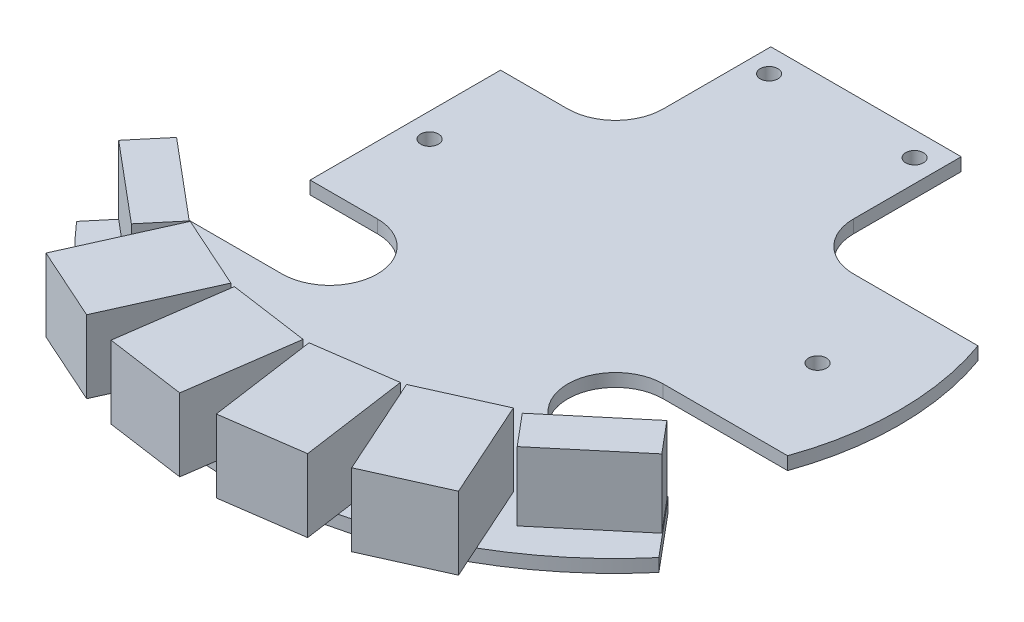
from build123d import *

# Parameters (mm, degrees)
BOSS_EXTRUDE1_DEPTH = 1.6
BOSS_EXTRUDE2_DEPTH = 8.5
BOSS_EXTRUDE3_DEPTH = 9
SKETCH4_R           = 1.1
CUT_EXTRUDE1_DEPTH  = 64.607734681


with BuildPart() as part:
    # Sketch1 → Boss-Extrude1 (new body)
    with BuildSketch(Plane(origin=(0, 0, 0), x_dir=(1, 0, 0), z_dir=(0, 1, 0))):
        with BuildLine():
            Line((-11.77766953, 17.67766953), (-11.77766953, 31))
            Line((-11.77766953, 31), (11.77766953, 31))
            Line((11.77766953, 31), (11.77766953, 17.67766953))
            ThreePointArc((11.77766953, 17.67766953), (13.505739521, 13.505739521), (17.67766953, 11.77766953))
            Line((17.67766953, 11.77766953), (33.07278358, 11.77766953))
            ThreePointArc((33.07278358, 11.77766953), (35.1073, 0), (33.07278358, -11.77766953))
            Line((33.07278358, -11.77766953), (17.67766953, -11.77766953))
            ThreePointArc((17.67766953, -11.77766953), (11.77766953, -17.67766953), (17.67766953, -23.57766953))
            Line((17.67766953, -23.57766953), (30.09766953, -23.57766953))
            Line((30.09766953, -23.57766953), (36.017643771, -30.655106364))
            ThreePointArc((36.017643771, -30.655106364), (0, -47.297), (-36.017643771, -30.655106364))
            Line((-36.017643771, -30.655106364), (-30.09766953, -23.57766953))
            Line((-30.09766953, -23.57766953), (-17.67766953, -23.57766953))
            ThreePointArc((-17.67766953, -23.57766953), (-11.77766953, -17.67766953), (-17.67766953, -11.77766953))
            Line((-17.67766953, -11.77766953), (-26, -11.77766953))
            Line((-26, -11.77766953), (-26, 11.77766953))
            Line((-26, 11.77766953), (-17.67766953, 11.77766953))
            ThreePointArc((-17.67766953, 11.77766953), (-13.505739521, 13.505739521), (-11.77766953, 17.67766953))
        make_face()
    extrude(amount=BOSS_EXTRUDE1_DEPTH)

    # Sketch2 → Boss-Extrude2 (add)
    with BuildSketch(Plane(origin=(0, 1.6, 0), x_dir=(1, 0, 0), z_dir=(0, 1, 0))):
        Polygon((-33.597062742, -27.864051564), (-23.868298315, -36.027454207), (-20.602937258, -32.135948436), (-30.331701685, -23.972545793), align=None)
        Polygon((23.868298315, -36.027454207), (33.597062742, -27.864051564), (30.331701685, -23.972545793), (20.602937258, -32.135948436), align=None)
    extrude(amount=BOSS_EXTRUDE2_DEPTH)

    # Sketch3 → Boss-Extrude3 (add)
    with BuildSketch(Plane(origin=(0, 1.6, 0), x_dir=(1, 0, 0), z_dir=(0, 1, 0))):
        Polygon((-25.517948101, -44.939697826), (-19.990220336, -32.623276846), (-10.866945536, -36.717890005), (-16.394673301, -49.034310985), align=None)
        Polygon((-0.36916096, -38.28278004), (-2.261296496, -51.649523215), (-12.162587737, -50.247941336), (-10.2704522, -36.881198161), align=None)
        Polygon((2.261296496, -51.649523215), (0.36916096, -38.28278004), (10.2704522, -36.881198161), (12.162587737, -50.247941336), align=None)
        Polygon((16.394673301, -49.034310985), (10.866945536, -36.717890005), (19.990220336, -32.623276846), (25.517948101, -44.939697826), align=None)
    extrude(amount=BOSS_EXTRUDE3_DEPTH)

    # Sketch4 → Cut-Extrude1 (cut, through all)
    with BuildSketch(Plane(origin=(0, 1.6, 0), x_dir=(1, 0, 0), z_dir=(0, 1, 0))):
        with Locations(Location((0, -34.8, 0), (0, 0, 270))):
            Circle(SKETCH4_R)
        with Locations(Location((25, 0, 0), (0, 0, 270))):
            Circle(SKETCH4_R)
        with Locations(Location((-23, 0, 0), (0, 0, 270))):
            Circle(SKETCH4_R)
        with Locations(Location((-9, 28, 0), (0, 0, 270))):
            Circle(SKETCH4_R)
        with Locations(Location((9, 28, 0), (0, 0, 270))):
            Circle(SKETCH4_R)
    extrude(amount=-CUT_EXTRUDE1_DEPTH, mode=Mode.SUBTRACT)


solid = part.part
